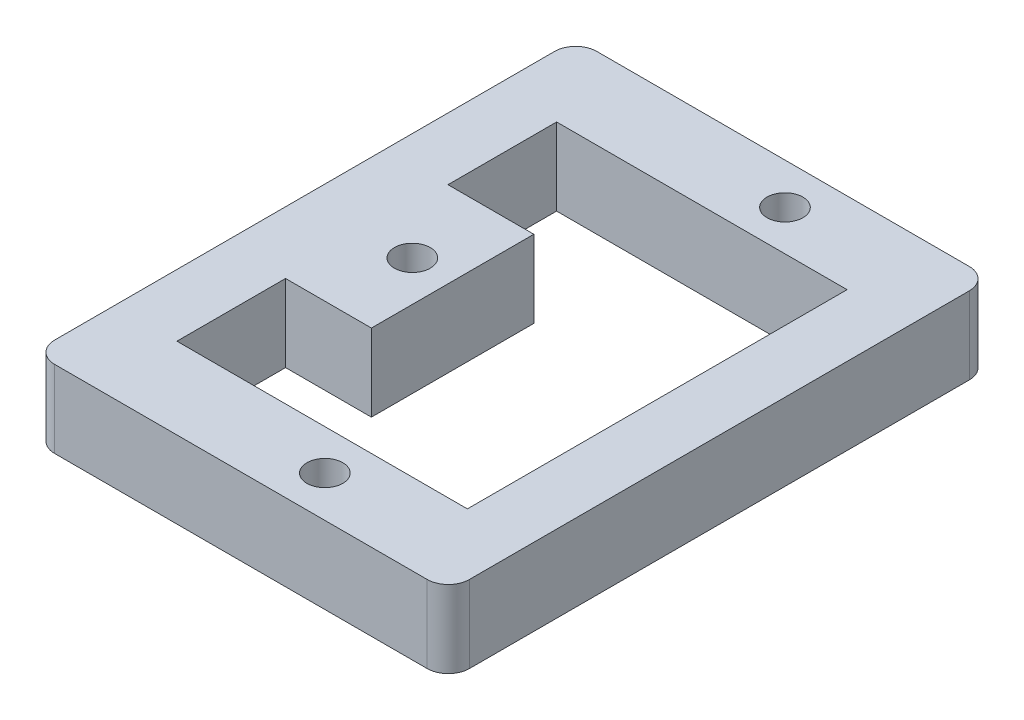
from build123d import *

# Parameters (mm, degrees)
SKETCH1_W           = 24.9682
SKETCH1_H           = 32.639
BOSS_EXTRUDE1_DEPTH = 4.6482
SKETCH2_R           = 1.0795
CUT_EXTRUDE1_DEPTH  = 4.6482
FILLET1_R           = 1.27


with BuildPart() as part:
    # Sketch1 → Boss-Extrude1 (new body)
    with BuildSketch(Plane(origin=(0, 0, 0), x_dir=(1, 0, 0), z_dir=(0, 1, 0))):
        Rectangle(SKETCH1_W, SKETCH1_H)
        Polygon((8.743727626, 11.43), (8.743727626, -11.43), (-8.743727626, -11.43), (-8.743727626, -4.8895), (-3.575272374, -4.8895), (-3.575272374, 4.8895), (-8.743727626, 4.8895), (-8.743727626, 11.43), align=None, mode=Mode.SUBTRACT)
    extrude(amount=BOSS_EXTRUDE1_DEPTH)

    # Sketch2 → Cut-Extrude1 (cut)
    with BuildSketch(Plane(origin=(0, 4.6482, 0), x_dir=(1, 0, 0), z_dir=(0, 1, 0))):
        with Locations(Location((2.584227626, 13.85062, 0), (0, 0, 270))):
            Circle(SKETCH2_R)
        with Locations(Location((2.584227626, -13.85062, 0), (0, 0, 270))):
            Circle(SKETCH2_R)
        with Locations(Location((-6.000972374, 0, 0), (0, 0, 270))):
            Circle(SKETCH2_R)
    extrude(amount=-CUT_EXTRUDE1_DEPTH, mode=Mode.SUBTRACT)

    # Fillet1
    fillet1_edges = [part.edges().sort_by_distance(p)[0] for p in [
        (-12.4841, 2.3241, 16.3195),
        (12.4841, 2.3241, 16.3195),
        (12.4841, 2.3241, -16.3195),
        (-12.4841, 2.3241, -16.3195),
    ]]
    fillet(fillet1_edges, radius=FILLET1_R)


solid = part.part
